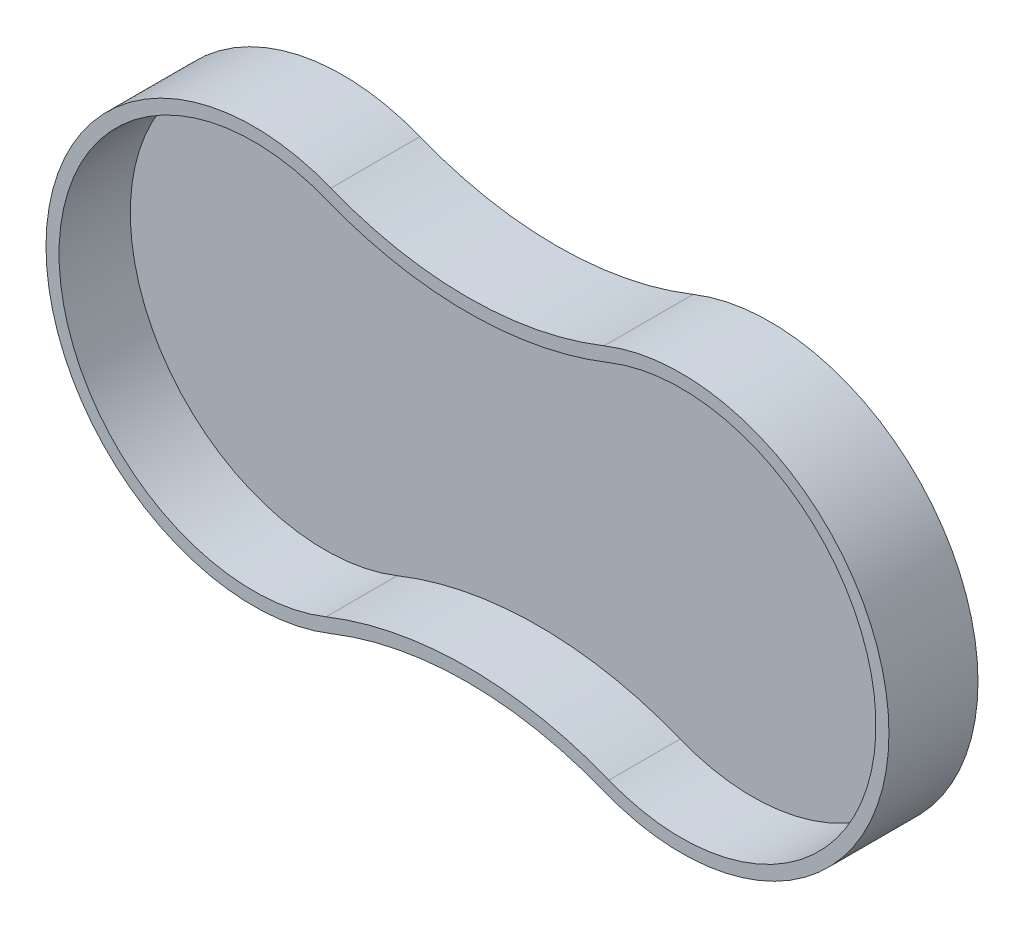
from build123d import *

# Parameters (mm, degrees)
BOSS_EXTRUDE1_DEPTH = 15
CUT_EXTRUDE2_DEPTH  = 12


with BuildPart() as part:
    # Sketch1 → Boss-Extrude1 (new body)
    with BuildSketch(Plane.XY):
        with BuildLine():
            ThreePointArc((-23.009618943, 32.5), (-71, 0), (-23.009618943, -32.5))
            ThreePointArc((-23.009618943, -32.5), (0, -28.07179677), (23.009618943, -32.5))
            ThreePointArc((23.009618943, -32.5), (71, 0), (23.009618943, 32.5))
            ThreePointArc((23.009618943, 32.5), (0, 28.07179677), (-23.009618943, 32.5))
        make_face()
    extrude(amount=BOSS_EXTRUDE1_DEPTH)

    # Sketch2 → Cut-Extrude2 (cut)
    with BuildSketch(Plane.XY.offset(15)):
        with BuildLine():
            ThreePointArc((-23.826157181, 30.457142857), (0, 25.87179677), (23.826157181, 30.457142857))
            ThreePointArc((23.826157181, 30.457142857), (68.8, 0), (23.826157181, -30.457142857))
            ThreePointArc((23.826157181, -30.457142857), (0, -25.87179677), (-23.826157181, -30.457142857))
            ThreePointArc((-23.826157181, -30.457142857), (-68.8, 0), (-23.826157181, 30.457142857))
        make_face()
    extrude(amount=-CUT_EXTRUDE2_DEPTH, mode=Mode.SUBTRACT)


solid = part.part
